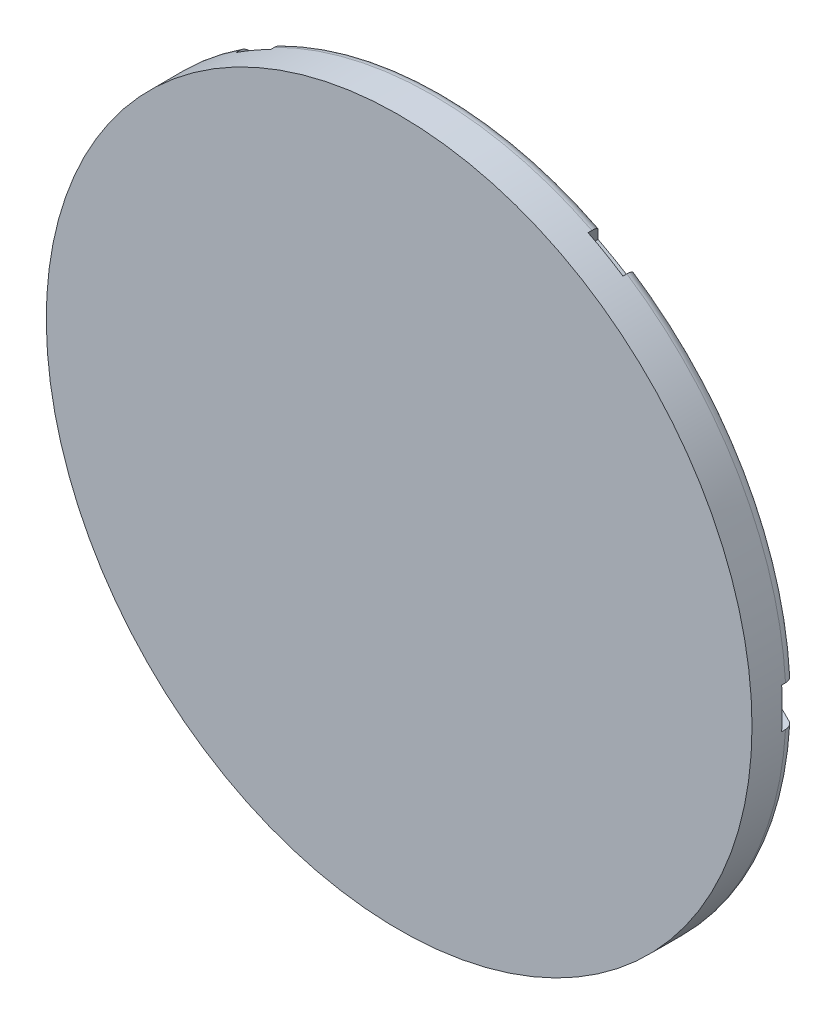
from build123d import *

# Parameters (mm, degrees)
SKETCH1_R           = 17.5
BASE_EXTRUDE_DEPTH  = 2
CHAMFER1_SIZE       = 2
CHAMFER1_SIZE2      = 1
FILLET8_R           = 0.5
SKETCH2_W           = 4
SKETCH2_H           = 2
CUT_EXTRUDE1_DEPTH  = 1.5
CIRPATTERN1_COUNT   = 6
SKETCH3_R           = 17.5
BOSS_EXTRUDE1_DEPTH = 1


with BuildPart() as part:
    # Sketch1 → Base-Extrude (new body)
    with BuildSketch(Plane.XY):
        Circle(SKETCH1_R)
    extrude(amount=BASE_EXTRUDE_DEPTH)

    # Chamfer1
    chamfer1_edges = [part.edges().sort_by_distance(p)[0] for p in [
        (-17.5, 0, 0),
    ]]
    chamfer1_side = [part.faces().sort_by_distance(p)[0] for p in [
        (0, 0, 0),
    ]]
    chamfer(chamfer1_edges, length=CHAMFER1_SIZE, length2=CHAMFER1_SIZE2, reference=chamfer1_side[0])

    # Fillet8
    fillet8_edges = [part.edges().sort_by_distance(p)[0] for p in [
        (-17.5, 0, 1),
        (-15.5, 0, 0),
    ]]
    fillet(fillet8_edges, radius=FILLET8_R)

    # Sketch2 → Cut-Extrude1 (cut)
    with BuildSketch(Plane(origin=(0, 0, 0), x_dir=(-1, 0, 0), z_dir=(0, 0, -1))):
        with Locations((18, 0)):
            Rectangle(SKETCH2_W, SKETCH2_H)
    cut_extrude1 = extrude(amount=-CUT_EXTRUDE1_DEPTH, mode=Mode.SUBTRACT)

    # CirPattern1: Cut-Extrude1 ×6 about axis
    cirpattern1_axis = Axis((0, 0, 0), (0, 0, -1))
    for i in range(1, CIRPATTERN1_COUNT):
        add(cut_extrude1.rotate(cirpattern1_axis, i * 360 / CIRPATTERN1_COUNT), mode=Mode.SUBTRACT)

    # Sketch3 → Boss-Extrude1 (add)
    with BuildSketch(Plane.XY.offset(2)):
        Circle(SKETCH3_R)
    extrude(amount=BOSS_EXTRUDE1_DEPTH)


solid = part.part
